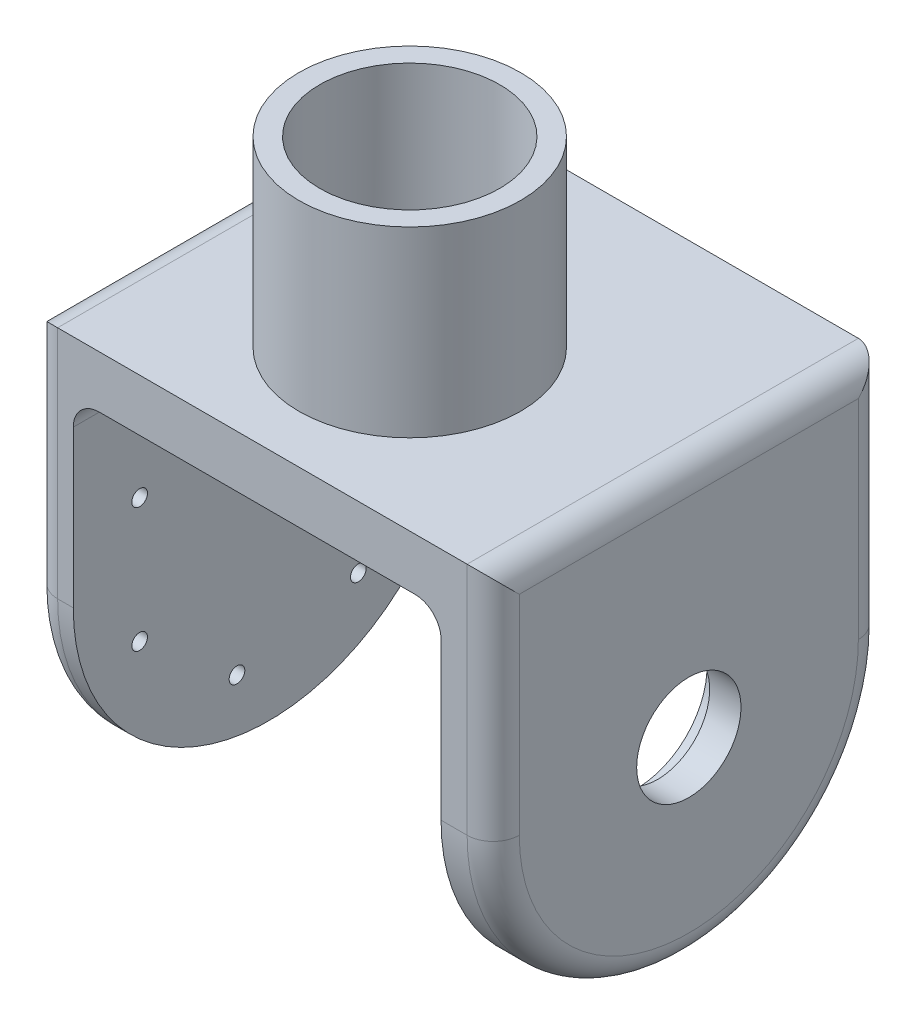
from build123d import *

# Parameters (mm, degrees)
CROQUIS1_R              = 1.5
SALIENTE_EXTRUIR1_DEPTH = 8
CROQUIS2_W              = 75
CROQUIS2_H              = 10
SALIENTE_EXTRUIR2_DEPTH = 78.5
SALIENTE_EXTRUIR4_REACH = 148.201
CROQUIS6_R              = 21.25
CROQUIS6_R_2            = 17.25
CROQUIS7_R              = 10
SALIENTE_EXTRUIR5_DEPTH = 10
CROQUIS8_R              = 22.5
CROQUIS8_R_2            = 15
CORTAR_EXTRUIR1_DEPTH   = 2
CROQUIS9_R              = 13.5
CORTAR_EXTRUIR2_DEPTH   = 4
REDONDEO1_R             = 5


with BuildPart() as part:
    # Croquis1 → Saliente-Extruir1 (new body)
    with BuildSketch(Plane(origin=(0, 0, 0), x_dir=(0, 0, -1), z_dir=(1, 0, 0))):
        with BuildLine():
            Line((-37.5, 0), (-37.5, 45))
            Line((-37.5, 45), (37.5, 45))
            Line((37.5, 45), (37.5, 0))
            ThreePointArc((37.5, 0), (0, -37.5), (-37.5, 0))
        make_face()
        with Locations((27.5, 0)):
            Circle(CROQUIS1_R, mode=Mode.SUBTRACT)
        with Locations((17.145969551, -21.500365768)):
            Circle(CROQUIS1_R, mode=Mode.SUBTRACT)
        with Locations((-6.119325684, -26.810517585)):
            Circle(CROQUIS1_R, mode=Mode.SUBTRACT)
        with Locations((-24.776643867, -11.931802826)):
            Circle(CROQUIS1_R, mode=Mode.SUBTRACT)
        with Locations((-24.776643867, 11.931802826)):
            Circle(CROQUIS1_R, mode=Mode.SUBTRACT)
        with Locations((-6.119325684, 26.810517585)):
            Circle(CROQUIS1_R, mode=Mode.SUBTRACT)
        with Locations((17.145969551, 21.500365768)):
            Circle(CROQUIS1_R, mode=Mode.SUBTRACT)
    extrude(amount=SALIENTE_EXTRUIR1_DEPTH)

    # Croquis2 → Saliente-Extruir2 (add)
    with BuildSketch(Plane(origin=(0, 0, 0), x_dir=(0, 0, -1), z_dir=(1, 0, 0))):
        with Locations((0, 40)):
            Rectangle(CROQUIS2_W, CROQUIS2_H)
    extrude(amount=SALIENTE_EXTRUIR2_DEPTH)


with BuildPart() as body_2:

    # Croquis6 → Saliente-Extruir4 (new, up to next)
    with BuildSketch(Plane(origin=(0, 80, 0), x_dir=(1, 0, 0), z_dir=(0, 1, 0)), mode=Mode.PRIVATE) as saliente_extruir4_sk1:
        with Locations(Location((42, -7, 0), (0, 0, 270))):
            Circle(CROQUIS6_R)
        with Locations(Location((42, -7, 0), (0, 0, 270))):
            Circle(CROQUIS6_R_2, mode=Mode.SUBTRACT)
    saliente_extruir4_tool1 = extrude(saliente_extruir4_sk1.sketch, amount=-SALIENTE_EXTRUIR4_REACH, mode=Mode.PRIVATE) - part.part
    add(saliente_extruir4_tool1.solids().sort_by_distance((42, 80, -13.648959))[0])


with BuildPart() as part_1:
    add(part.part)

    # Croquis7 → Saliente-Extruir5 (add)
    with BuildSketch(Plane(origin=(78.5, 0, 0), x_dir=(0, 0, -1), z_dir=(1, 0, 0))):
        with BuildLine():
            Line((-37.5, 0), (-37.5, 45))
            Line((-37.5, 45), (37.5, 45))
            Line((37.5, 45), (37.5, 0))
            ThreePointArc((37.5, 0), (0, -37.5), (-37.5, 0))
        make_face()
        Circle(CROQUIS7_R, mode=Mode.SUBTRACT)
    extrude(amount=SALIENTE_EXTRUIR5_DEPTH)

    # Croquis8 → Cortar-Extruir1 (cut)
    with BuildSketch(Plane.ZY.offset(-78.5)):
        Circle(CROQUIS8_R)
        Circle(CROQUIS8_R_2, mode=Mode.SUBTRACT)
    extrude(amount=-CORTAR_EXTRUIR1_DEPTH, mode=Mode.SUBTRACT)

    # Croquis9 → Cortar-Extruir2 (cut)
    with BuildSketch(Plane.ZY.offset(-78.5)):
        Circle(CROQUIS9_R)
    extrude(amount=-CORTAR_EXTRUIR2_DEPTH, mode=Mode.SUBTRACT)

    # Redondeo1
    redondeo1_edges = [part_1.edges().sort_by_distance(p)[0] for p in [
        (8, 35, 0),
        (78.5, 35, 0),
        (0, 22.5, 37.5),
        (0, 45, 0),
        (0, 22.5, -37.5),
        (0, -37.5, 0),
        (88.5, -37.5, 0),
        (88.5, 22.5, -37.5),
        (88.5, 45, 0),
        (88.5, 22.5, 37.5),
    ]]
    fillet(redondeo1_edges, radius=REDONDEO1_R)


solid = Compound([body_2.part, part_1.part])
